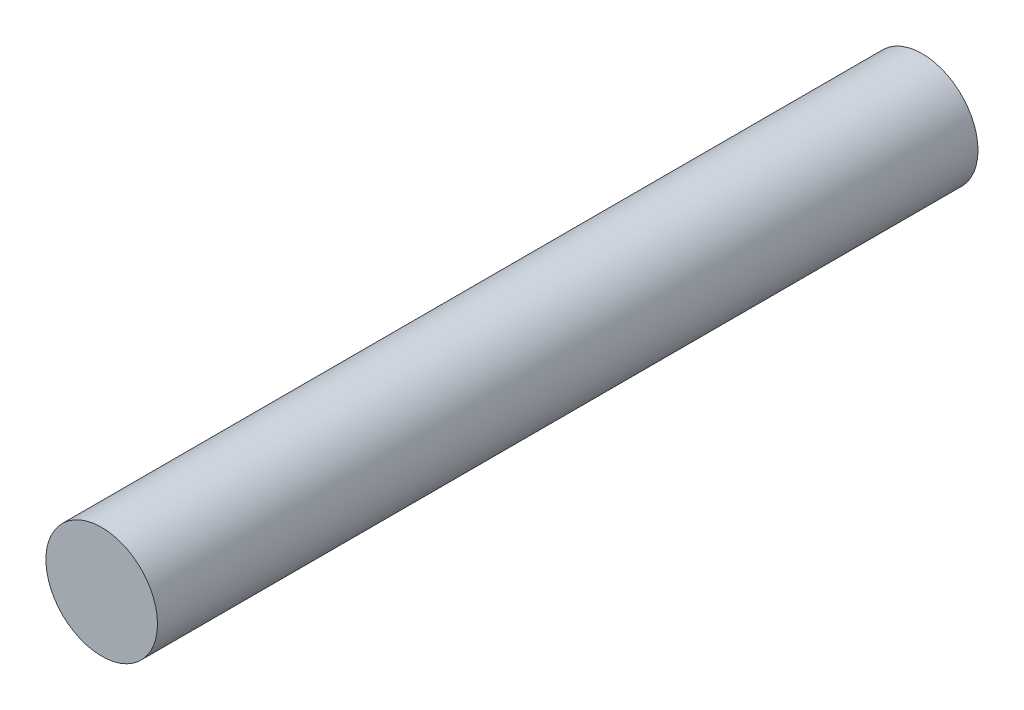
from build123d import *

# Parameters (mm, degrees)
SCHIZZO1_R                   = 1.7
ESTRUSIONE_ESTRUSIONE1_DEPTH = 25


with BuildPart() as part:
    # Schizzo1 → Estrusione-Estrusione1 (new body)
    with BuildSketch(Plane.XY):
        with Locations((-9.734665943, -1.05037081)):
            Circle(SCHIZZO1_R)
    extrude(amount=ESTRUSIONE_ESTRUSIONE1_DEPTH)


solid = part.part
